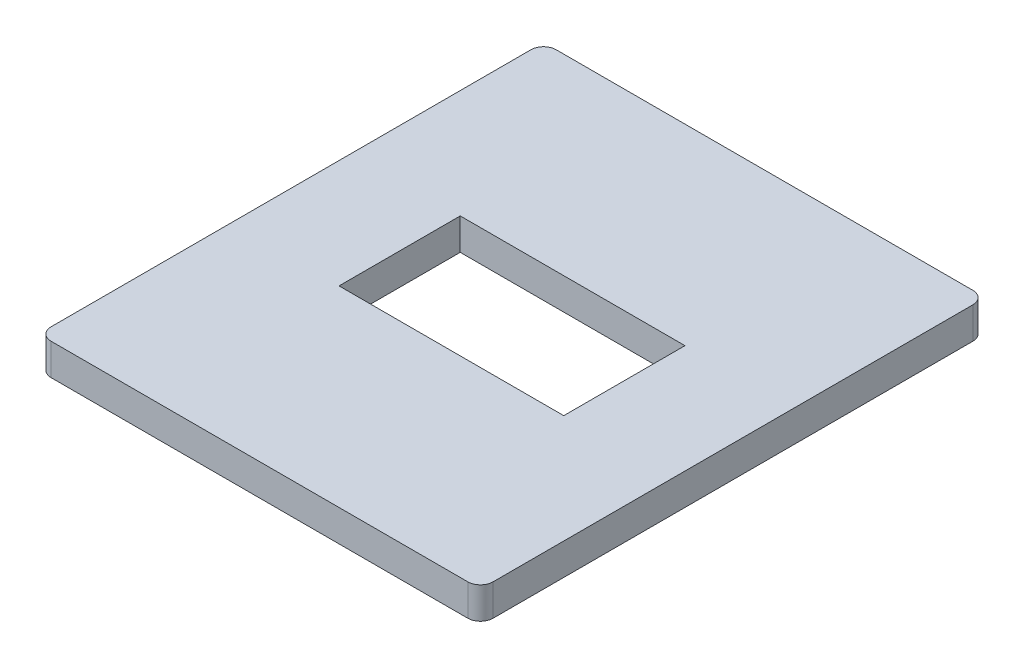
from build123d import *

# Parameters (mm, degrees)
SKETCH1_W           = 44.45
SKETCH1_H           = 50.8
SKETCH1_W_2         = 22.606
SKETCH1_H_2         = 12.192
BOSS_EXTRUDE1_DEPTH = 3.175
FILLET1_R           = 1.27


with BuildPart() as part:
    # Sketch1 → Boss-Extrude1 (new body)
    with BuildSketch(Plane(origin=(0, 0, 0), x_dir=(1, 0, 0), z_dir=(0, 1, 0))):
        with Locations((-0.329912538, 1.556243023)):
            Rectangle(SKETCH1_W, SKETCH1_H)
        with Locations((-0.329912538, 1.556243023)):
            Rectangle(SKETCH1_W_2, SKETCH1_H_2, mode=Mode.SUBTRACT)
    extrude(amount=BOSS_EXTRUDE1_DEPTH)

    # Fillet1
    fillet1_edges = [part.edges().sort_by_distance(p)[0] for p in [
        (-22.554912538, 1.5875, 23.843756977),
        (-22.554912538, 1.5875, -26.956243023),
        (21.895087462, 1.5875, -26.956243023),
        (21.895087462, 1.5875, 23.843756977),
    ]]
    fillet(fillet1_edges, radius=FILLET1_R)


solid = part.part
